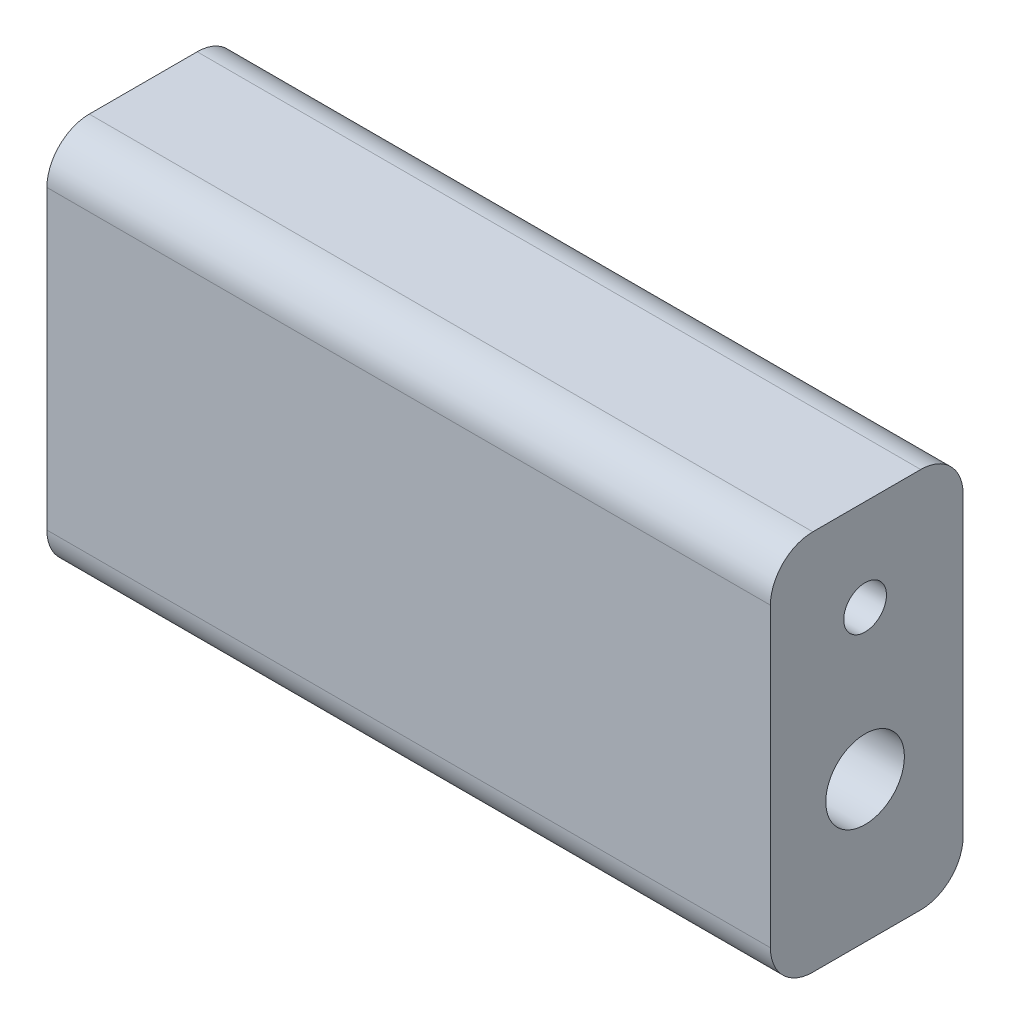
from build123d import *

# Parameters (mm, degrees)
SKETCH1_W           = 42.7
SKETCH1_H           = 22.51
BOSS_EXTRUDE1_DEPTH = 11.37
FILLET1_R           = 2.5
SKETCH2_R           = 1.26
SKETCH2_R_2         = 2.32
CUT_EXTRUDE1_DEPTH  = 12


with BuildPart() as part:
    # Sketch1 → Boss-Extrude1 (new body)
    with BuildSketch(Plane.XY):
        Rectangle(SKETCH1_W, SKETCH1_H)
    extrude(amount=BOSS_EXTRUDE1_DEPTH)

    # Fillet1
    fillet1_edges = [part.edges().sort_by_distance(p)[0] for p in [
        (0, -11.255, 11.37),
        (0, -11.255, 0),
        (0, 11.255, 0),
        (0, 11.255, 11.37),
    ]]
    fillet(fillet1_edges, radius=FILLET1_R)

    # Sketch2 → Cut-Extrude1 (cut)
    with BuildSketch(Plane(origin=(21.35, 0, 0), x_dir=(0, 0, -1), z_dir=(1, 0, 0))):
        with Locations((-5.784105099, 5.852044752)):
            Circle(SKETCH2_R)
        with Locations((-5.784105099, -2.931681994)):
            Circle(SKETCH2_R_2)
    extrude(amount=-CUT_EXTRUDE1_DEPTH, mode=Mode.SUBTRACT)


solid = part.part
